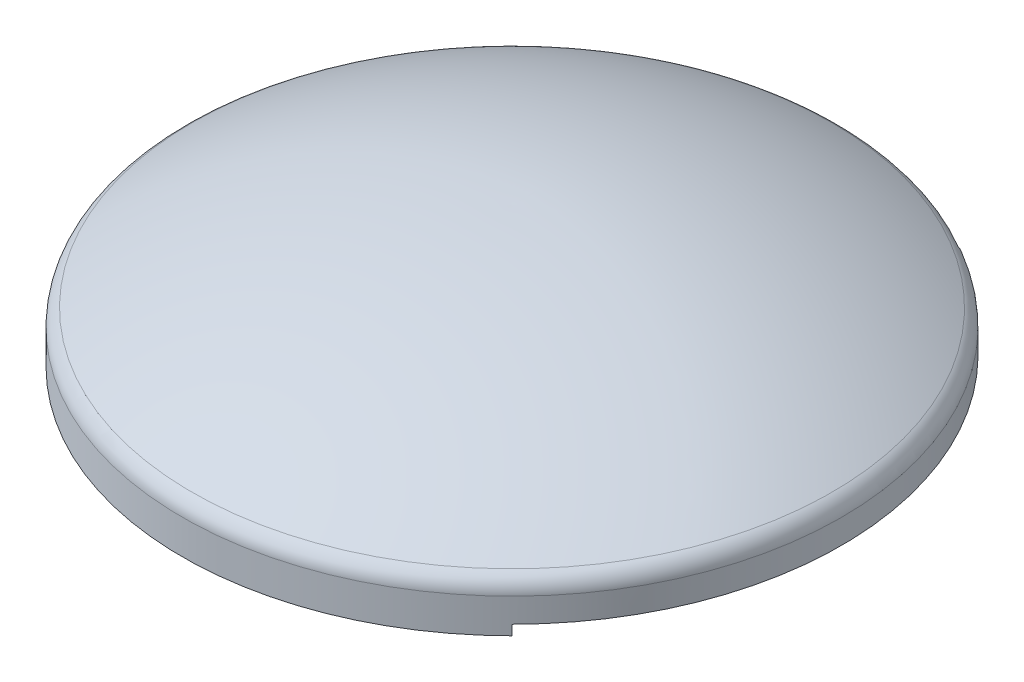
from build123d import *

# Parameters (mm, degrees)
CUT_REVOLVE1_ANGLE = 270
FILLET1_R          = 2
CUT_EXTRUDE1_REACH = 50.452
SKETCH3_W          = 33
SKETCH3_H          = 3.55


with BuildPart() as part:
    # Sketch1 → Revolve1 (revolve)
    with BuildSketch(Plane(origin=(0, 0, 0), x_dir=(0, 0, -1), z_dir=(1, 0, 0))):
        with BuildLine():
            ThreePointArc((0, 13.021377037), (17.192696052, 10.691622039), (33, 3.54))
            Line((33, 3.54), (33, -1))
            Line((33, -1), (25, -1))
            Line((25, -1), (25, 0))
            Line((25, 0), (30, 0))
            Line((30, 0), (30.977536905, 0))
            Line((30.977536905, 0), (30.977536905, 3.54543462))
            ThreePointArc((30.977536905, 3.54543462), (15.995495353, 9.387188497), (0, 11.04))
            Line((0, 11.04), (0, 13.021377037))
        make_face()
    revolve(axis=Axis((0, 11.04, 0), (0, 1, 0)))

    # Sketch2 → Cut-Revolve1 (revolve, symmetric, cut)
    with BuildSketch(Plane(origin=(0, 0, 0), x_dir=(0, 0, -1), z_dir=(1, 0, 0))) as cut_revolve1_sk:
        Polygon((30.977536905, 0), (25, 0), (25, -1), (33, -1), (33, 0), align=None)
    revolve(axis=Axis((0, 10.04, 0), (0, -1, 0)), revolution_arc=CUT_REVOLVE1_ANGLE / 2, mode=Mode.SUBTRACT)
    revolve(cut_revolve1_sk.sketch, axis=Axis((0, 10.04, 0), (0, 1, 0)), revolution_arc=CUT_REVOLVE1_ANGLE / 2, mode=Mode.SUBTRACT)

    # Fillet1
    fillet1_edges = [part.edges().sort_by_distance(p)[0] for p in [
        (0, 3.54, 33),
    ]]
    fillet(fillet1_edges, radius=FILLET1_R)

    # Sketch3 → Cut-Extrude1 (cut, up to next)
    with BuildSketch(Plane.XY, mode=Mode.PRIVATE) as cut_extrude1_sk1:
        with Locations((0, 1.775)):
            Rectangle(SKETCH3_W, SKETCH3_H)
    cut_extrude1_tool1 = extrude(cut_extrude1_sk1.sketch, amount=-CUT_EXTRUDE1_REACH, mode=Mode.PRIVATE) & part.part
    add(cut_extrude1_tool1.solids().sort_by_distance((0, 1.775, 0))[0], mode=Mode.SUBTRACT)


solid = part.part
